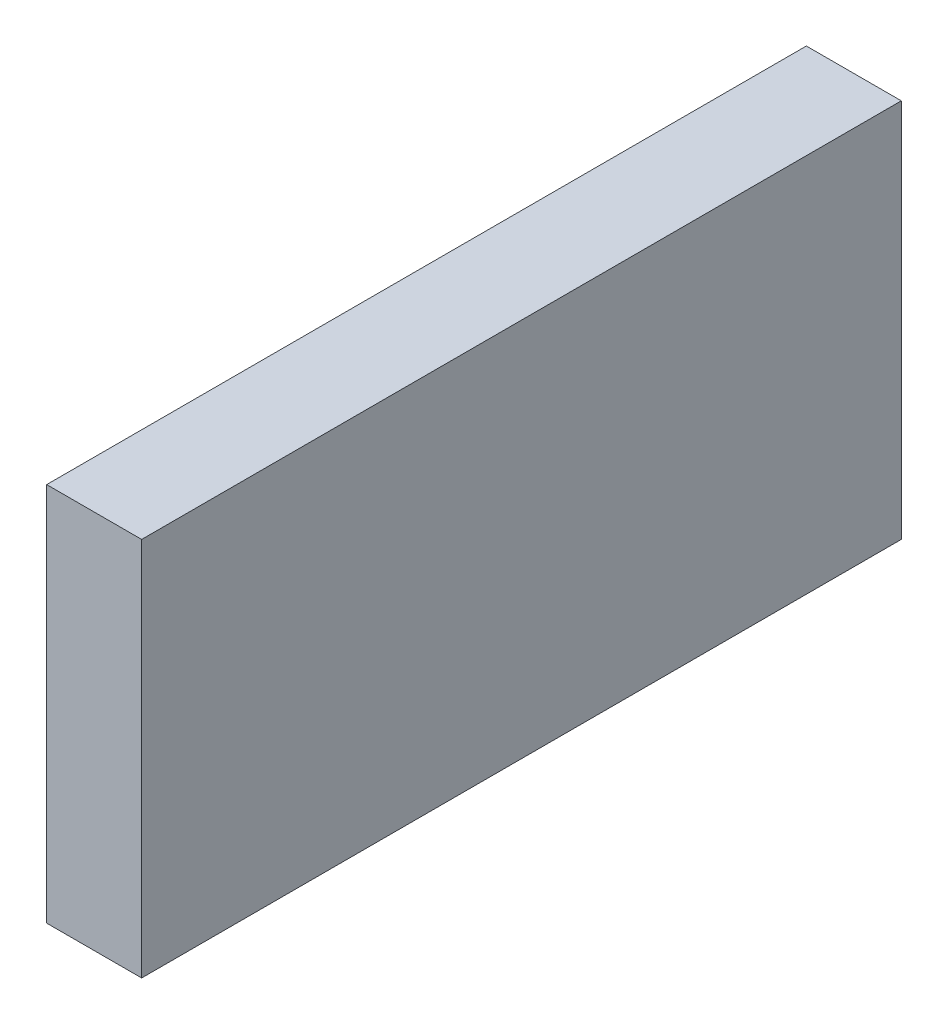
from build123d import *

# Parameters (mm, degrees)
SKETCH2_W           = 1.5
SKETCH2_H           = 12
BOSS_EXTRUDE1_DEPTH = 6


with BuildPart() as part:
    # Sketch2 → Boss-Extrude1 (new body)
    with BuildSketch(Plane(origin=(0, 0, 0), x_dir=(1, 0, 0), z_dir=(0, 1, 0))):
        with Locations((-0.727588655, -2.604612222)):
            Rectangle(SKETCH2_W, SKETCH2_H)
    extrude(amount=BOSS_EXTRUDE1_DEPTH)


solid = part.part
